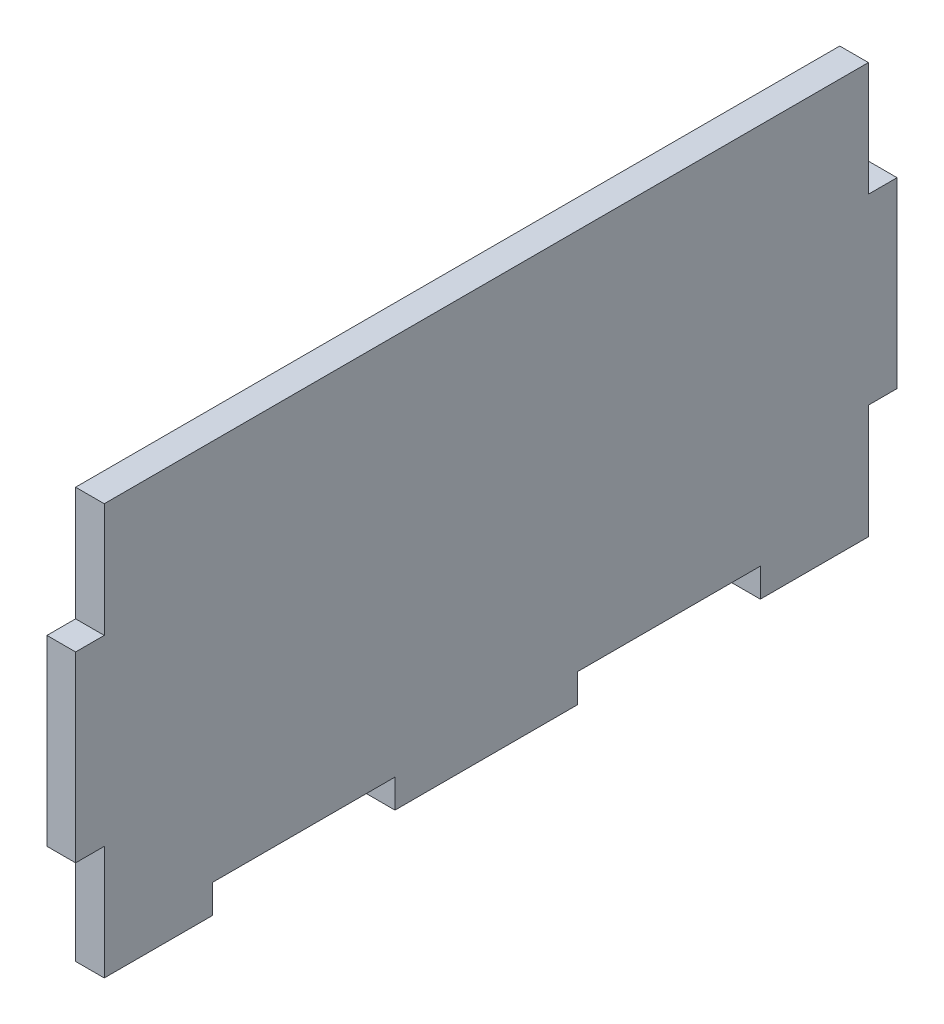
from build123d import *

# Parameters (mm, degrees)
BOSS_EXTRUDE1_DEPTH = 3


with BuildPart() as part:
    # Sketch1 → Boss-Extrude1 (new body)
    with BuildSketch(Plane(origin=(0, 0, 0), x_dir=(0, 0, -1), z_dir=(1, 0, 0))):
        Polygon((17.318961808, -27.221117537), (17.318961808, -39.158617537), (14.318961808, -39.158617537), (14.318961808, -58.283617537), (17.318961808, -58.283617537), (17.318961808, -70.221117537), (28.631461808, -70.221117537), (28.631461808, -67.221117537), (47.756461808, -67.221117537), (47.756461808, -70.221117537), (66.881461808, -70.221117537), (66.881461808, -67.221117537), (86.006461808, -67.221117537), (86.006461808, -70.221117537), (97.318961808, -70.221117537), (97.318961808, -58.283617537), (100.318961808, -58.283617537), (100.318961808, -39.158617537), (97.318961808, -39.158617537), (97.318961808, -27.221117537), align=None)
    extrude(amount=BOSS_EXTRUDE1_DEPTH)


solid = part.part
